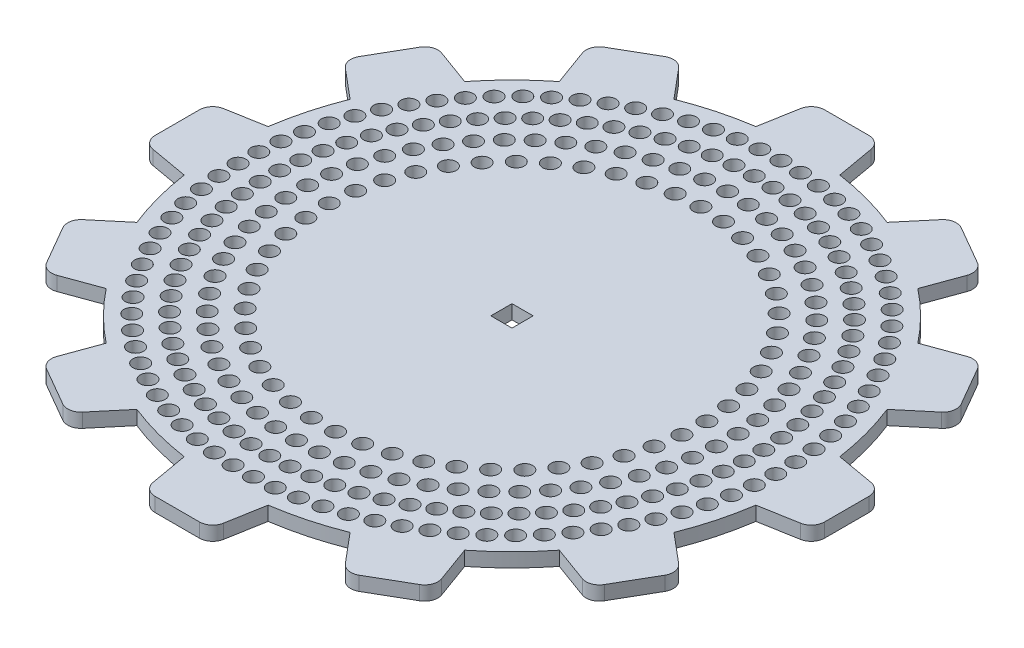
from build123d import *

# Parameters (mm, degrees)
SKETCH1_R           = 130
SKETCH1_R_2         = 3.5
SKETCH1_W           = 9.525
SKETCH1_H           = 9.525
BOSS_EXTRUDE1_DEPTH = 6.35
BOSS_EXTRUDE2_START = -6.35
BOSS_EXTRUDE2_DEPTH = 6.35
FILLET3_R           = 6
FILLET4_R           = 6


with BuildPart() as part:
    # Sketch1 → Boss-Extrude1 (new body)
    with BuildSketch(Plane(origin=(0, 0, 0), x_dir=(1, 0, 0), z_dir=(0, 1, 0))):
        with Locations(Location((0, 0, 0), (0, 0, 270))):
            Circle(SKETCH1_R)
        with Locations(Location((0, 85, 0), (0, 0, 270))):
            Circle(SKETCH1_R_2, mode=Mode.SUBTRACT)
        with Locations(Location((0, 97, 0), (0, 0, 270))):
            Circle(SKETCH1_R_2, mode=Mode.SUBTRACT)
        with Locations(Location((0, 109, 0), (0, 0, 270))):
            Circle(SKETCH1_R_2, mode=Mode.SUBTRACT)
        with Locations(Location((0, 121, 0), (0, 0, 270))):
            Circle(SKETCH1_R_2, mode=Mode.SUBTRACT)
        with Locations(Location((9.151078252, 120.653461479, 0), (0, 0, 270))):
            Circle(SKETCH1_R_2, mode=Mode.SUBTRACT)
        with Locations(Location((18.249739957, 119.615830857, 0), (0, 0, 270))):
            Circle(SKETCH1_R_2, mode=Mode.SUBTRACT)
        with Locations(Location((27.243868803, 117.893051588, 0), (0, 0, 270))):
            Circle(SKETCH1_R_2, mode=Mode.SUBTRACT)
        with Locations(Location((36.081947237, 115.494991595, 0), (0, 0, 270))):
            Circle(SKETCH1_R_2, mode=Mode.SUBTRACT)
        with Locations(Location((44.713351544, 112.43538675, 0), (0, 0, 270))):
            Circle(SKETCH1_R_2, mode=Mode.SUBTRACT)
        with Locations(Location((53.088641823, 108.731762192, 0), (0, 0, 270))):
            Circle(SKETCH1_R_2, mode=Mode.SUBTRACT)
        with Locations(Location((61.159845169, 104.405331947, 0), (0, 0, 270))):
            Circle(SKETCH1_R_2, mode=Mode.SUBTRACT)
        with Locations(Location((68.88073046, 99.480877415, 0), (0, 0, 270))):
            Circle(SKETCH1_R_2, mode=Mode.SUBTRACT)
        with Locations(Location((76.207073165, 93.986605426, 0), (0, 0, 270))):
            Circle(SKETCH1_R_2, mode=Mode.SUBTRACT)
        with Locations(Location((83.096908657, 87.953986673, 0), (0, 0, 270))):
            Circle(SKETCH1_R_2, mode=Mode.SUBTRACT)
        with Locations(Location((89.510772581, 81.417575449, 0), (0, 0, 270))):
            Circle(SKETCH1_R_2, mode=Mode.SUBTRACT)
        with Locations(Location((95.411926905, 74.414811726, 0), (0, 0, 270))):
            Circle(SKETCH1_R_2, mode=Mode.SUBTRACT)
        with Locations(Location((100.766570353, 66.985806701, 0), (0, 0, 270))):
            Circle(SKETCH1_R_2, mode=Mode.SUBTRACT)
        with Locations(Location((105.544032011, 59.17311304, 0), (0, 0, 270))):
            Circle(SKETCH1_R_2, mode=Mode.SUBTRACT)
        with Locations(Location((109.716947011, 51.021481147, 0), (0, 0, 270))):
            Circle(SKETCH1_R_2, mode=Mode.SUBTRACT)
        with Locations(Location((113.261413276, 42.577602831, 0), (0, 0, 270))):
            Circle(SKETCH1_R_2, mode=Mode.SUBTRACT)
        with Locations(Location((116.157128421, 33.889843861, 0), (0, 0, 270))):
            Circle(SKETCH1_R_2, mode=Mode.SUBTRACT)
        with Locations(Location((118.387506054, 25.007966935, 0), (0, 0, 270))):
            Circle(SKETCH1_R_2, mode=Mode.SUBTRACT)
        with Locations(Location((119.939770774, 15.982846639, 0), (0, 0, 270))):
            Circle(SKETCH1_R_2, mode=Mode.SUBTRACT)
        with Locations(Location((120.805031348, 6.866178044, 0), (0, 0, 270))):
            Circle(SKETCH1_R_2, mode=Mode.SUBTRACT)
        with Locations(Location((120.978331643, -2.289819396, 0), (0, 0, 270))):
            Circle(SKETCH1_R_2, mode=Mode.SUBTRACT)
        with Locations(Location((120.45867901, -11.432700958, 0), (0, 0, 270))):
            Circle(SKETCH1_R_2, mode=Mode.SUBTRACT)
        with Locations(Location((119.249049972, -20.510097045, 0), (0, 0, 270))):
            Circle(SKETCH1_R_2, mode=Mode.SUBTRACT)
        with Locations(Location((117.356373175, -29.470013153, 0), (0, 0, 270))):
            Circle(SKETCH1_R_2, mode=Mode.SUBTRACT)
        with Locations(Location((114.7914897, -38.261127695, 0), (0, 0, 270))):
            Circle(SKETCH1_R_2, mode=Mode.SUBTRACT)
        with Locations(Location((111.569090968, -46.833085961, 0), (0, 0, 270))):
            Circle(SKETCH1_R_2, mode=Mode.SUBTRACT)
        with Locations(Location((107.707634586, -55.136788553, 0), (0, 0, 270))):
            Circle(SKETCH1_R_2, mode=Mode.SUBTRACT)
        with Locations(Location((103.229238627, -63.124672613, 0), (0, 0, 270))):
            Circle(SKETCH1_R_2, mode=Mode.SUBTRACT)
        with Locations(Location((98.159554937, -70.750984265, 0), (0, 0, 270))):
            Circle(SKETCH1_R_2, mode=Mode.SUBTRACT)
        with Locations(Location((92.527622207, -77.972040686, 0), (0, 0, 270))):
            Circle(SKETCH1_R_2, mode=Mode.SUBTRACT)
        with Locations(Location((86.365699635, -84.746480319, 0), (0, 0, 270))):
            Circle(SKETCH1_R_2, mode=Mode.SUBTRACT)
        with Locations(Location((79.709082157, -91.035499788, 0), (0, 0, 270))):
            Circle(SKETCH1_R_2, mode=Mode.SUBTRACT)
        with Locations(Location((72.595898275, -96.803076158, 0), (0, 0, 270))):
            Circle(SKETCH1_R_2, mode=Mode.SUBTRACT)
        with Locations(Location((65.066891662, -102.016173274, 0), (0, 0, 270))):
            Circle(SKETCH1_R_2, mode=Mode.SUBTRACT)
        with Locations(Location((57.165187786, -106.644930988, 0), (0, 0, 270))):
            Circle(SKETCH1_R_2, mode=Mode.SUBTRACT)
        with Locations(Location((48.936046891, -110.662836195, 0), (0, 0, 270))):
            Circle(SKETCH1_R_2, mode=Mode.SUBTRACT)
        with Locations(Location((40.426604751, -114.046874698, 0), (0, 0, 270))):
            Circle(SKETCH1_R_2, mode=Mode.SUBTRACT)
        with Locations(Location((31.68560268, -116.77766303, 0), (0, 0, 270))):
            Circle(SKETCH1_R_2, mode=Mode.SUBTRACT)
        with Locations(Location((22.763108347, -118.839559484, 0), (0, 0, 270))):
            Circle(SKETCH1_R_2, mode=Mode.SUBTRACT)
        with Locations(Location((13.71022899, -120.220753704, 0), (0, 0, 270))):
            Circle(SKETCH1_R_2, mode=Mode.SUBTRACT)
        with Locations(Location((4.578818683, -120.913334333, 0), (0, 0, 270))):
            Circle(SKETCH1_R_2, mode=Mode.SUBTRACT)
        with Locations(Location((-4.578818683, -120.913334333, 0), (0, 0, 270))):
            Circle(SKETCH1_R_2, mode=Mode.SUBTRACT)
        with Locations(Location((-13.71022899, -120.220753704, 0), (0, 0, 270))):
            Circle(SKETCH1_R_2, mode=Mode.SUBTRACT)
        with Locations(Location((-22.763108347, -118.839559484, 0), (0, 0, 270))):
            Circle(SKETCH1_R_2, mode=Mode.SUBTRACT)
        with Locations(Location((-31.68560268, -116.77766303, 0), (0, 0, 270))):
            Circle(SKETCH1_R_2, mode=Mode.SUBTRACT)
        with Locations(Location((-40.426604751, -114.046874698, 0), (0, 0, 270))):
            Circle(SKETCH1_R_2, mode=Mode.SUBTRACT)
        with Locations(Location((-48.936046891, -110.662836195, 0), (0, 0, 270))):
            Circle(SKETCH1_R_2, mode=Mode.SUBTRACT)
        with Locations(Location((-57.165187786, -106.644930988, 0), (0, 0, 270))):
            Circle(SKETCH1_R_2, mode=Mode.SUBTRACT)
        with Locations(Location((-65.066891662, -102.016173274, 0), (0, 0, 270))):
            Circle(SKETCH1_R_2, mode=Mode.SUBTRACT)
        with Locations(Location((-72.595898275, -96.803076158, 0), (0, 0, 270))):
            Circle(SKETCH1_R_2, mode=Mode.SUBTRACT)
        with Locations(Location((-79.709082157, -91.035499788, 0), (0, 0, 270))):
            Circle(SKETCH1_R_2, mode=Mode.SUBTRACT)
        with Locations(Location((-86.365699635, -84.746480319, 0), (0, 0, 270))):
            Circle(SKETCH1_R_2, mode=Mode.SUBTRACT)
        with Locations(Location((-92.527622207, -77.972040686, 0), (0, 0, 270))):
            Circle(SKETCH1_R_2, mode=Mode.SUBTRACT)
        with Locations(Location((-98.159554937, -70.750984265, 0), (0, 0, 270))):
            Circle(SKETCH1_R_2, mode=Mode.SUBTRACT)
        with Locations(Location((-103.229238627, -63.124672613, 0), (0, 0, 270))):
            Circle(SKETCH1_R_2, mode=Mode.SUBTRACT)
        with Locations(Location((-107.707634586, -55.136788553, 0), (0, 0, 270))):
            Circle(SKETCH1_R_2, mode=Mode.SUBTRACT)
        with Locations(Location((-111.569090968, -46.833085961, 0), (0, 0, 270))):
            Circle(SKETCH1_R_2, mode=Mode.SUBTRACT)
        with Locations(Location((-114.7914897, -38.261127695, 0), (0, 0, 270))):
            Circle(SKETCH1_R_2, mode=Mode.SUBTRACT)
        with Locations(Location((-117.356373175, -29.470013153, 0), (0, 0, 270))):
            Circle(SKETCH1_R_2, mode=Mode.SUBTRACT)
        with Locations(Location((-119.249049972, -20.510097045, 0), (0, 0, 270))):
            Circle(SKETCH1_R_2, mode=Mode.SUBTRACT)
        with Locations(Location((-120.45867901, -11.432700958, 0), (0, 0, 270))):
            Circle(SKETCH1_R_2, mode=Mode.SUBTRACT)
        with Locations(Location((-120.978331643, -2.289819396, 0), (0, 0, 270))):
            Circle(SKETCH1_R_2, mode=Mode.SUBTRACT)
        with Locations(Location((-120.805031348, 6.866178044, 0), (0, 0, 270))):
            Circle(SKETCH1_R_2, mode=Mode.SUBTRACT)
        with Locations(Location((-119.939770774, 15.982846639, 0), (0, 0, 270))):
            Circle(SKETCH1_R_2, mode=Mode.SUBTRACT)
        with Locations(Location((-118.387506054, 25.007966935, 0), (0, 0, 270))):
            Circle(SKETCH1_R_2, mode=Mode.SUBTRACT)
        with Locations(Location((8.77085599, 108.646546587, 0), (0, 0, 270))):
            Circle(SKETCH1_R_2, mode=Mode.SUBTRACT)
        with Locations(Location((17.484829613, 107.588478628, 0), (0, 0, 270))):
            Circle(SKETCH1_R_2, mode=Mode.SUBTRACT)
        with Locations(Location((26.085407407, 105.832658099, 0), (0, 0, 270))):
            Circle(SKETCH1_R_2, mode=Mode.SUBTRACT)
        with Locations(Location((34.516811324, 103.390472172, 0), (0, 0, 270))):
            Circle(SKETCH1_R_2, mode=Mode.SUBTRACT)
        with Locations(Location((42.724360475, 100.277759359, 0), (0, 0, 270))):
            Circle(SKETCH1_R_2, mode=Mode.SUBTRACT)
        with Locations(Location((50.654825753, 96.514706796, 0), (0, 0, 270))):
            Circle(SKETCH1_R_2, mode=Mode.SUBTRACT)
        with Locations(Location((58.256775048, 92.125719324, 0), (0, 0, 270))):
            Circle(SKETCH1_R_2, mode=Mode.SUBTRACT)
        with Locations(Location((65.480906802, 87.139261211, 0), (0, 0, 270))):
            Circle(SKETCH1_R_2, mode=Mode.SUBTRACT)
        with Locations(Location((72.280369748, 81.587671551, 0), (0, 0, 270))):
            Circle(SKETCH1_R_2, mode=Mode.SUBTRACT)
        with Locations(Location((78.61106676, 75.506954533, 0), (0, 0, 270))):
            Circle(SKETCH1_R_2, mode=Mode.SUBTRACT)
        with Locations(Location((84.431940839, 68.93654594, 0), (0, 0, 270))):
            Circle(SKETCH1_R_2, mode=Mode.SUBTRACT)
        with Locations(Location((89.705241382, 61.919057394, 0), (0, 0, 270))):
            Circle(SKETCH1_R_2, mode=Mode.SUBTRACT)
        with Locations(Location((94.396769013, 54.5, 0), (0, 0, 270))):
            Circle(SKETCH1_R_2, mode=Mode.SUBTRACT)
        with Locations(Location((98.476097373, 46.727489193, 0), (0, 0, 270))):
            Circle(SKETCH1_R_2, mode=Mode.SUBTRACT)
        with Locations(Location((101.916770453, 38.651932688, 0), (0, 0, 270))):
            Circle(SKETCH1_R_2, mode=Mode.SUBTRACT)
        with Locations(Location((104.696474168, 30.325703567, 0), (0, 0, 270))):
            Circle(SKETCH1_R_2, mode=Mode.SUBTRACT)
        with Locations(Location((106.797181073, 21.802800622, 0), (0, 0, 270))):
            Circle(SKETCH1_R_2, mode=Mode.SUBTRACT)
        with Locations(Location((108.205267277, 13.138498148, 0), (0, 0, 270))):
            Circle(SKETCH1_R_2, mode=Mode.SUBTRACT)
        with Locations(Location((108.911600801, 4.388987472, 0), (0, 0, 270))):
            Circle(SKETCH1_R_2, mode=Mode.SUBTRACT)
        with Locations(Location((108.911600801, -4.388987472, 0), (0, 0, 270))):
            Circle(SKETCH1_R_2, mode=Mode.SUBTRACT)
        with Locations(Location((108.205267277, -13.138498148, 0), (0, 0, 270))):
            Circle(SKETCH1_R_2, mode=Mode.SUBTRACT)
        with Locations(Location((106.797181073, -21.802800622, 0), (0, 0, 270))):
            Circle(SKETCH1_R_2, mode=Mode.SUBTRACT)
        with Locations(Location((104.696474168, -30.325703567, 0), (0, 0, 270))):
            Circle(SKETCH1_R_2, mode=Mode.SUBTRACT)
        with Locations(Location((101.916770453, -38.651932688, 0), (0, 0, 270))):
            Circle(SKETCH1_R_2, mode=Mode.SUBTRACT)
        with Locations(Location((98.476097373, -46.727489193, 0), (0, 0, 270))):
            Circle(SKETCH1_R_2, mode=Mode.SUBTRACT)
        with Locations(Location((94.396769013, -54.5, 0), (0, 0, 270))):
            Circle(SKETCH1_R_2, mode=Mode.SUBTRACT)
        with Locations(Location((89.705241382, -61.919057394, 0), (0, 0, 270))):
            Circle(SKETCH1_R_2, mode=Mode.SUBTRACT)
        with Locations(Location((84.431940839, -68.93654594, 0), (0, 0, 270))):
            Circle(SKETCH1_R_2, mode=Mode.SUBTRACT)
        with Locations(Location((78.61106676, -75.506954533, 0), (0, 0, 270))):
            Circle(SKETCH1_R_2, mode=Mode.SUBTRACT)
        with Locations(Location((72.280369748, -81.587671551, 0), (0, 0, 270))):
            Circle(SKETCH1_R_2, mode=Mode.SUBTRACT)
        with Locations(Location((65.480906802, -87.139261211, 0), (0, 0, 270))):
            Circle(SKETCH1_R_2, mode=Mode.SUBTRACT)
        with Locations(Location((58.256775048, -92.125719324, 0), (0, 0, 270))):
            Circle(SKETCH1_R_2, mode=Mode.SUBTRACT)
        with Locations(Location((50.654825753, -96.514706796, 0), (0, 0, 270))):
            Circle(SKETCH1_R_2, mode=Mode.SUBTRACT)
        with Locations(Location((42.724360475, -100.277759359, 0), (0, 0, 270))):
            Circle(SKETCH1_R_2, mode=Mode.SUBTRACT)
        with Locations(Location((34.516811324, -103.390472172, 0), (0, 0, 270))):
            Circle(SKETCH1_R_2, mode=Mode.SUBTRACT)
        with Locations(Location((26.085407407, -105.832658099, 0), (0, 0, 270))):
            Circle(SKETCH1_R_2, mode=Mode.SUBTRACT)
        with Locations(Location((17.484829614, -107.588478628, 0), (0, 0, 270))):
            Circle(SKETCH1_R_2, mode=Mode.SUBTRACT)
        with Locations(Location((8.77085599, -108.646546587, 0), (0, 0, 270))):
            Circle(SKETCH1_R_2, mode=Mode.SUBTRACT)
        with Locations(Location((0, -109, 0), (0, 0, 270))):
            Circle(SKETCH1_R_2, mode=Mode.SUBTRACT)
        with Locations(Location((-8.77085599, -108.646546587, 0), (0, 0, 270))):
            Circle(SKETCH1_R_2, mode=Mode.SUBTRACT)
        with Locations(Location((-17.484829613, -107.588478628, 0), (0, 0, 270))):
            Circle(SKETCH1_R_2, mode=Mode.SUBTRACT)
        with Locations(Location((-26.085407407, -105.832658099, 0), (0, 0, 270))):
            Circle(SKETCH1_R_2, mode=Mode.SUBTRACT)
        with Locations(Location((-34.516811324, -103.390472172, 0), (0, 0, 270))):
            Circle(SKETCH1_R_2, mode=Mode.SUBTRACT)
        with Locations(Location((-42.724360475, -100.277759359, 0), (0, 0, 270))):
            Circle(SKETCH1_R_2, mode=Mode.SUBTRACT)
        with Locations(Location((-50.654825753, -96.514706796, 0), (0, 0, 270))):
            Circle(SKETCH1_R_2, mode=Mode.SUBTRACT)
        with Locations(Location((-58.256775048, -92.125719324, 0), (0, 0, 270))):
            Circle(SKETCH1_R_2, mode=Mode.SUBTRACT)
        with Locations(Location((-65.480906802, -87.139261211, 0), (0, 0, 270))):
            Circle(SKETCH1_R_2, mode=Mode.SUBTRACT)
        with Locations(Location((-72.280369748, -81.587671551, 0), (0, 0, 270))):
            Circle(SKETCH1_R_2, mode=Mode.SUBTRACT)
        with Locations(Location((-78.61106676, -75.506954533, 0), (0, 0, 270))):
            Circle(SKETCH1_R_2, mode=Mode.SUBTRACT)
        with Locations(Location((-84.431940839, -68.93654594, 0), (0, 0, 270))):
            Circle(SKETCH1_R_2, mode=Mode.SUBTRACT)
        with Locations(Location((-89.705241382, -61.919057394, 0), (0, 0, 270))):
            Circle(SKETCH1_R_2, mode=Mode.SUBTRACT)
        with Locations(Location((-94.396769012, -54.5, 0), (0, 0, 270))):
            Circle(SKETCH1_R_2, mode=Mode.SUBTRACT)
        with Locations(Location((-98.476097373, -46.727489193, 0), (0, 0, 270))):
            Circle(SKETCH1_R_2, mode=Mode.SUBTRACT)
        with Locations(Location((-101.916770453, -38.651932688, 0), (0, 0, 270))):
            Circle(SKETCH1_R_2, mode=Mode.SUBTRACT)
        with Locations(Location((9.813327233, 96.502324369, 0), (0, 0, 270))):
            Circle(SKETCH1_R_2, mode=Mode.SUBTRACT)
        with Locations(Location((19.525956449, 95.014404301, 0), (0, 0, 270))):
            Circle(SKETCH1_R_2, mode=Mode.SUBTRACT)
        with Locations(Location((29.038222928, 92.551507871, 0), (0, 0, 270))):
            Circle(SKETCH1_R_2, mode=Mode.SUBTRACT)
        with Locations(Location((38.252517946, 89.138907727, 0), (0, 0, 270))):
            Circle(SKETCH1_R_2, mode=Mode.SUBTRACT)
        with Locations(Location((47.074290366, 84.811621766, 0), (0, 0, 270))):
            Circle(SKETCH1_R_2, mode=Mode.SUBTRACT)
        with Locations(Location((55.413016864, 79.614053797, 0), (0, 0, 270))):
            Circle(SKETCH1_R_2, mode=Mode.SUBTRACT)
        with Locations(Location((63.183130824, 73.599537901, 0), (0, 0, 270))):
            Circle(SKETCH1_R_2, mode=Mode.SUBTRACT)
        with Locations(Location((70.304900361, 66.82979115, 0), (0, 0, 270))):
            Circle(SKETCH1_R_2, mode=Mode.SUBTRACT)
        with Locations(Location((76.705246483, 59.374280307, 0), (0, 0, 270))):
            Circle(SKETCH1_R_2, mode=Mode.SUBTRACT)
        with Locations(Location((82.318492977, 51.309509002, 0), (0, 0, 270))):
            Circle(SKETCH1_R_2, mode=Mode.SUBTRACT)
        with Locations(Location((87.087040338, 42.718232701, 0), (0, 0, 270))):
            Circle(SKETCH1_R_2, mode=Mode.SUBTRACT)
        with Locations(Location((90.961956818, 33.688609526, 0), (0, 0, 270))):
            Circle(SKETCH1_R_2, mode=Mode.SUBTRACT)
        with Locations(Location((93.90348053, 24.313295629, 0), (0, 0, 270))):
            Circle(SKETCH1_R_2, mode=Mode.SUBTRACT)
        with Locations(Location((95.88142746, 14.688494418, 0), (0, 0, 270))):
            Circle(SKETCH1_R_2, mode=Mode.SUBTRACT)
        with Locations(Location((96.875501196, 4.912969377, 0), (0, 0, 270))):
            Circle(SKETCH1_R_2, mode=Mode.SUBTRACT)
        with Locations(Location((96.875501196, -4.912969377, 0), (0, 0, 270))):
            Circle(SKETCH1_R_2, mode=Mode.SUBTRACT)
        with Locations(Location((95.88142746, -14.688494418, 0), (0, 0, 270))):
            Circle(SKETCH1_R_2, mode=Mode.SUBTRACT)
        with Locations(Location((93.90348053, -24.313295629, 0), (0, 0, 270))):
            Circle(SKETCH1_R_2, mode=Mode.SUBTRACT)
        with Locations(Location((90.961956818, -33.688609526, 0), (0, 0, 270))):
            Circle(SKETCH1_R_2, mode=Mode.SUBTRACT)
        with Locations(Location((87.087040338, -42.718232701, 0), (0, 0, 270))):
            Circle(SKETCH1_R_2, mode=Mode.SUBTRACT)
        with Locations(Location((82.318492977, -51.309509002, 0), (0, 0, 270))):
            Circle(SKETCH1_R_2, mode=Mode.SUBTRACT)
        with Locations(Location((76.705246483, -59.374280307, 0), (0, 0, 270))):
            Circle(SKETCH1_R_2, mode=Mode.SUBTRACT)
        with Locations(Location((70.304900361, -66.82979115, 0), (0, 0, 270))):
            Circle(SKETCH1_R_2, mode=Mode.SUBTRACT)
        with Locations(Location((63.183130824, -73.599537901, 0), (0, 0, 270))):
            Circle(SKETCH1_R_2, mode=Mode.SUBTRACT)
        with Locations(Location((55.413016864, -79.614053797, 0), (0, 0, 270))):
            Circle(SKETCH1_R_2, mode=Mode.SUBTRACT)
        with Locations(Location((47.074290366, -84.811621766, 0), (0, 0, 270))):
            Circle(SKETCH1_R_2, mode=Mode.SUBTRACT)
        with Locations(Location((38.252517946, -89.138907727, 0), (0, 0, 270))):
            Circle(SKETCH1_R_2, mode=Mode.SUBTRACT)
        with Locations(Location((29.038222928, -92.551507871, 0), (0, 0, 270))):
            Circle(SKETCH1_R_2, mode=Mode.SUBTRACT)
        with Locations(Location((19.525956449, -95.014404301, 0), (0, 0, 270))):
            Circle(SKETCH1_R_2, mode=Mode.SUBTRACT)
        with Locations(Location((9.813327233, -96.502324369, 0), (0, 0, 270))):
            Circle(SKETCH1_R_2, mode=Mode.SUBTRACT)
        with Locations(Location((0, -97, 0), (0, 0, 270))):
            Circle(SKETCH1_R_2, mode=Mode.SUBTRACT)
        with Locations(Location((-9.813327233, -96.502324369, 0), (0, 0, 270))):
            Circle(SKETCH1_R_2, mode=Mode.SUBTRACT)
        with Locations(Location((-19.525956449, -95.014404301, 0), (0, 0, 270))):
            Circle(SKETCH1_R_2, mode=Mode.SUBTRACT)
        with Locations(Location((-29.038222928, -92.551507871, 0), (0, 0, 270))):
            Circle(SKETCH1_R_2, mode=Mode.SUBTRACT)
        with Locations(Location((-38.252517946, -89.138907727, 0), (0, 0, 270))):
            Circle(SKETCH1_R_2, mode=Mode.SUBTRACT)
        with Locations(Location((-47.074290366, -84.811621766, 0), (0, 0, 270))):
            Circle(SKETCH1_R_2, mode=Mode.SUBTRACT)
        with Locations(Location((-55.413016864, -79.614053797, 0), (0, 0, 270))):
            Circle(SKETCH1_R_2, mode=Mode.SUBTRACT)
        with Locations(Location((-63.183130824, -73.599537901, 0), (0, 0, 270))):
            Circle(SKETCH1_R_2, mode=Mode.SUBTRACT)
        with Locations(Location((-70.304900361, -66.82979115, 0), (0, 0, 270))):
            Circle(SKETCH1_R_2, mode=Mode.SUBTRACT)
        with Locations(Location((-76.705246483, -59.374280307, 0), (0, 0, 270))):
            Circle(SKETCH1_R_2, mode=Mode.SUBTRACT)
        with Locations(Location((-82.318492977, -51.309509002, 0), (0, 0, 270))):
            Circle(SKETCH1_R_2, mode=Mode.SUBTRACT)
        with Locations(Location((-87.087040338, -42.718232701, 0), (0, 0, 270))):
            Circle(SKETCH1_R_2, mode=Mode.SUBTRACT)
        with Locations(Location((-90.961956818, -33.688609526, 0), (0, 0, 270))):
            Circle(SKETCH1_R_2, mode=Mode.SUBTRACT)
        with Locations(Location((-93.90348053, -24.313295629, 0), (0, 0, 270))):
            Circle(SKETCH1_R_2, mode=Mode.SUBTRACT)
        with Locations(Location((-95.88142746, -14.688494418, 0), (0, 0, 270))):
            Circle(SKETCH1_R_2, mode=Mode.SUBTRACT)
        with Locations(Location((-96.875501196, -4.912969377, 0), (0, 0, 270))):
            Circle(SKETCH1_R_2, mode=Mode.SUBTRACT)
        with Locations(Location((-96.875501196, 4.912969377, 0), (0, 0, 270))):
            Circle(SKETCH1_R_2, mode=Mode.SUBTRACT)
        with Locations(Location((-95.88142746, 14.688494418, 0), (0, 0, 270))):
            Circle(SKETCH1_R_2, mode=Mode.SUBTRACT)
        with Locations(Location((-93.90348053, 24.313295629, 0), (0, 0, 270))):
            Circle(SKETCH1_R_2, mode=Mode.SUBTRACT)
        with Locations(Location((-90.961956818, 33.688609526, 0), (0, 0, 270))):
            Circle(SKETCH1_R_2, mode=Mode.SUBTRACT)
        with Locations(Location((-87.087040338, 42.718232701, 0), (0, 0, 270))):
            Circle(SKETCH1_R_2, mode=Mode.SUBTRACT)
        with Locations(Location((10.869558743, 84.302151175, 0), (0, 0, 270))):
            Circle(SKETCH1_R_2, mode=Mode.SUBTRACT)
        with Locations(Location((21.560639632, 82.220063358, 0), (0, 0, 270))):
            Circle(SKETCH1_R_2, mode=Mode.SUBTRACT)
        with Locations(Location((31.897695415, 78.787924374, 0), (0, 0, 270))):
            Circle(SKETCH1_R_2, mode=Mode.SUBTRACT)
        with Locations(Location((41.71099192, 74.06208985, 0), (0, 0, 270))):
            Circle(SKETCH1_R_2, mode=Mode.SUBTRACT)
        with Locations(Location((50.839395092, 68.120157859, 0), (0, 0, 270))):
            Circle(SKETCH1_R_2, mode=Mode.SUBTRACT)
        with Locations(Location((59.133016801, 61.059694758, 0), (0, 0, 270))):
            Circle(SKETCH1_R_2, mode=Mode.SUBTRACT)
        with Locations(Location((66.45567601, 52.996633158, 0), (0, 0, 270))):
            Circle(SKETCH1_R_2, mode=Mode.SUBTRACT)
        with Locations(Location((72.687134855, 44.063368306, 0), (0, 0, 270))):
            Circle(SKETCH1_R_2, mode=Mode.SUBTRACT)
        with Locations(Location((77.725072956, 34.406584165, 0), (0, 0, 270))):
            Circle(SKETCH1_R_2, mode=Mode.SUBTRACT)
        with Locations(Location((81.486767508, 24.184844864, 0), (0, 0, 270))):
            Circle(SKETCH1_R_2, mode=Mode.SUBTRACT)
        with Locations(Location((83.91045159, 13.565991078, 0), (0, 0, 270))):
            Circle(SKETCH1_R_2, mode=Mode.SUBTRACT)
        with Locations(Location((84.956328377, 2.724384094, 0), (0, 0, 270))):
            Circle(SKETCH1_R_2, mode=Mode.SUBTRACT)
        with Locations(Location((84.607224601, -8.161957202, 0), (0, 0, 270))):
            Circle(SKETCH1_R_2, mode=Mode.SUBTRACT)
        with Locations(Location((82.868872535, -18.914279386, 0), (0, 0, 270))):
            Circle(SKETCH1_R_2, mode=Mode.SUBTRACT)
        with Locations(Location((79.769815874, -29.356029626, 0), (0, 0, 270))):
            Circle(SKETCH1_R_2, mode=Mode.SUBTRACT)
        with Locations(Location((75.360941042, -39.31575467, 0), (0, 0, 270))):
            Circle(SKETCH1_R_2, mode=Mode.SUBTRACT)
        with Locations(Location((69.714641641, -48.62991611, 0), (0, 0, 270))):
            Circle(SKETCH1_R_2, mode=Mode.SUBTRACT)
        with Locations(Location((62.923629751, -57.145575672, 0), (0, 0, 270))):
            Circle(SKETCH1_R_2, mode=Mode.SUBTRACT)
        with Locations(Location((55.099413601, -64.722906461, 0), (0, 0, 270))):
            Circle(SKETCH1_R_2, mode=Mode.SUBTRACT)
        with Locations(Location((46.370466603, -71.237488916, 0), (0, 0, 270))):
            Circle(SKETCH1_R_2, mode=Mode.SUBTRACT)
        with Locations(Location((36.880117825, -76.582353772, 0), (0, 0, 270))):
            Circle(SKETCH1_R_2, mode=Mode.SUBTRACT)
        with Locations(Location((26.784198532, -80.669738496, 0), (0, 0, 270))):
            Circle(SKETCH1_R_2, mode=Mode.SUBTRACT)
        with Locations(Location((16.24848344, -83.432528344, 0), (0, 0, 270))):
            Circle(SKETCH1_R_2, mode=Mode.SUBTRACT)
        with Locations(Location((5.445968698, -84.825358384, 0), (0, 0, 270))):
            Circle(SKETCH1_R_2, mode=Mode.SUBTRACT)
        with Locations(Location((-5.445968698, -84.825358384, 0), (0, 0, 270))):
            Circle(SKETCH1_R_2, mode=Mode.SUBTRACT)
        with Locations(Location((-16.24848344, -83.432528344, 0), (0, 0, 270))):
            Circle(SKETCH1_R_2, mode=Mode.SUBTRACT)
        with Locations(Location((-26.784198532, -80.669738496, 0), (0, 0, 270))):
            Circle(SKETCH1_R_2, mode=Mode.SUBTRACT)
        with Locations(Location((-36.880117825, -76.582353772, 0), (0, 0, 270))):
            Circle(SKETCH1_R_2, mode=Mode.SUBTRACT)
        with Locations(Location((-46.370466603, -71.237488916, 0), (0, 0, 270))):
            Circle(SKETCH1_R_2, mode=Mode.SUBTRACT)
        with Locations(Location((-55.099413601, -64.722906461, 0), (0, 0, 270))):
            Circle(SKETCH1_R_2, mode=Mode.SUBTRACT)
        with Locations(Location((-62.923629751, -57.145575672, 0), (0, 0, 270))):
            Circle(SKETCH1_R_2, mode=Mode.SUBTRACT)
        with Locations(Location((-69.714641641, -48.62991611, 0), (0, 0, 270))):
            Circle(SKETCH1_R_2, mode=Mode.SUBTRACT)
        with Locations(Location((-75.360941042, -39.31575467, 0), (0, 0, 270))):
            Circle(SKETCH1_R_2, mode=Mode.SUBTRACT)
        with Locations(Location((-79.769815874, -29.356029626, 0), (0, 0, 270))):
            Circle(SKETCH1_R_2, mode=Mode.SUBTRACT)
        with Locations(Location((-82.868872535, -18.914279386, 0), (0, 0, 270))):
            Circle(SKETCH1_R_2, mode=Mode.SUBTRACT)
        with Locations(Location((-84.607224601, -8.161957202, 0), (0, 0, 270))):
            Circle(SKETCH1_R_2, mode=Mode.SUBTRACT)
        with Locations(Location((-84.956328377, 2.724384094, 0), (0, 0, 270))):
            Circle(SKETCH1_R_2, mode=Mode.SUBTRACT)
        with Locations(Location((-83.91045159, 13.565991078, 0), (0, 0, 270))):
            Circle(SKETCH1_R_2, mode=Mode.SUBTRACT)
        with Locations(Location((-81.486767508, 24.184844864, 0), (0, 0, 270))):
            Circle(SKETCH1_R_2, mode=Mode.SUBTRACT)
        with Locations(Location((-77.725072956, 34.406584165, 0), (0, 0, 270))):
            Circle(SKETCH1_R_2, mode=Mode.SUBTRACT)
        with Locations(Location((-72.687134855, 44.063368306, 0), (0, 0, 270))):
            Circle(SKETCH1_R_2, mode=Mode.SUBTRACT)
        with Locations(Location((-66.45567601, 52.996633158, 0), (0, 0, 270))):
            Circle(SKETCH1_R_2, mode=Mode.SUBTRACT)
        with Locations(Location((-59.133016801, 61.059694758, 0), (0, 0, 270))):
            Circle(SKETCH1_R_2, mode=Mode.SUBTRACT)
        with Locations(Location((-50.839395092, 68.120157859, 0), (0, 0, 270))):
            Circle(SKETCH1_R_2, mode=Mode.SUBTRACT)
        with Locations(Location((-41.71099192, 74.06208985, 0), (0, 0, 270))):
            Circle(SKETCH1_R_2, mode=Mode.SUBTRACT)
        with Locations(Location((-31.897695415, 78.787924374, 0), (0, 0, 270))):
            Circle(SKETCH1_R_2, mode=Mode.SUBTRACT)
        with Locations(Location((-21.560639632, 82.220063358, 0), (0, 0, 270))):
            Circle(SKETCH1_R_2, mode=Mode.SUBTRACT)
        with Locations(Location((-10.869558743, 84.302151175, 0), (0, 0, 270))):
            Circle(SKETCH1_R_2, mode=Mode.SUBTRACT)
        with Locations(Location((-82.318492977, 51.309509002, 0), (0, 0, 270))):
            Circle(SKETCH1_R_2, mode=Mode.SUBTRACT)
        with Locations(Location((-76.705246483, 59.374280307, 0), (0, 0, 270))):
            Circle(SKETCH1_R_2, mode=Mode.SUBTRACT)
        with Locations(Location((-70.304900361, 66.82979115, 0), (0, 0, 270))):
            Circle(SKETCH1_R_2, mode=Mode.SUBTRACT)
        with Locations(Location((-63.183130824, 73.599537901, 0), (0, 0, 270))):
            Circle(SKETCH1_R_2, mode=Mode.SUBTRACT)
        with Locations(Location((-55.413016864, 79.614053797, 0), (0, 0, 270))):
            Circle(SKETCH1_R_2, mode=Mode.SUBTRACT)
        with Locations(Location((-47.074290366, 84.811621766, 0), (0, 0, 270))):
            Circle(SKETCH1_R_2, mode=Mode.SUBTRACT)
        with Locations(Location((-38.252517946, 89.138907727, 0), (0, 0, 270))):
            Circle(SKETCH1_R_2, mode=Mode.SUBTRACT)
        with Locations(Location((-29.038222928, 92.551507871, 0), (0, 0, 270))):
            Circle(SKETCH1_R_2, mode=Mode.SUBTRACT)
        with Locations(Location((-19.525956449, 95.014404301, 0), (0, 0, 270))):
            Circle(SKETCH1_R_2, mode=Mode.SUBTRACT)
        with Locations(Location((-9.813327233, 96.502324369, 0), (0, 0, 270))):
            Circle(SKETCH1_R_2, mode=Mode.SUBTRACT)
        with Locations(Location((-104.696474168, -30.325703567, 0), (0, 0, 270))):
            Circle(SKETCH1_R_2, mode=Mode.SUBTRACT)
        with Locations(Location((-106.797181073, -21.802800622, 0), (0, 0, 270))):
            Circle(SKETCH1_R_2, mode=Mode.SUBTRACT)
        with Locations(Location((-108.205267277, -13.138498148, 0), (0, 0, 270))):
            Circle(SKETCH1_R_2, mode=Mode.SUBTRACT)
        with Locations(Location((-108.911600801, -4.388987472, 0), (0, 0, 270))):
            Circle(SKETCH1_R_2, mode=Mode.SUBTRACT)
        with Locations(Location((-108.911600801, 4.388987472, 0), (0, 0, 270))):
            Circle(SKETCH1_R_2, mode=Mode.SUBTRACT)
        with Locations(Location((-108.205267277, 13.138498148, 0), (0, 0, 270))):
            Circle(SKETCH1_R_2, mode=Mode.SUBTRACT)
        with Locations(Location((-106.797181073, 21.802800622, 0), (0, 0, 270))):
            Circle(SKETCH1_R_2, mode=Mode.SUBTRACT)
        with Locations(Location((-104.696474168, 30.325703567, 0), (0, 0, 270))):
            Circle(SKETCH1_R_2, mode=Mode.SUBTRACT)
        with Locations(Location((-101.916770453, 38.651932688, 0), (0, 0, 270))):
            Circle(SKETCH1_R_2, mode=Mode.SUBTRACT)
        with Locations(Location((-98.476097373, 46.727489193, 0), (0, 0, 270))):
            Circle(SKETCH1_R_2, mode=Mode.SUBTRACT)
        with Locations(Location((-94.396769012, 54.5, 0), (0, 0, 270))):
            Circle(SKETCH1_R_2, mode=Mode.SUBTRACT)
        with Locations(Location((-89.705241382, 61.919057394, 0), (0, 0, 270))):
            Circle(SKETCH1_R_2, mode=Mode.SUBTRACT)
        with Locations(Location((-84.431940839, 68.93654594, 0), (0, 0, 270))):
            Circle(SKETCH1_R_2, mode=Mode.SUBTRACT)
        with Locations(Location((-78.61106676, 75.506954533, 0), (0, 0, 270))):
            Circle(SKETCH1_R_2, mode=Mode.SUBTRACT)
        with Locations(Location((-72.280369748, 81.587671551, 0), (0, 0, 270))):
            Circle(SKETCH1_R_2, mode=Mode.SUBTRACT)
        with Locations(Location((-65.480906802, 87.139261211, 0), (0, 0, 270))):
            Circle(SKETCH1_R_2, mode=Mode.SUBTRACT)
        with Locations(Location((-58.256775048, 92.125719324, 0), (0, 0, 270))):
            Circle(SKETCH1_R_2, mode=Mode.SUBTRACT)
        with Locations(Location((-50.654825753, 96.514706796, 0), (0, 0, 270))):
            Circle(SKETCH1_R_2, mode=Mode.SUBTRACT)
        with Locations(Location((-42.724360475, 100.277759359, 0), (0, 0, 270))):
            Circle(SKETCH1_R_2, mode=Mode.SUBTRACT)
        with Locations(Location((-34.516811324, 103.390472172, 0), (0, 0, 270))):
            Circle(SKETCH1_R_2, mode=Mode.SUBTRACT)
        with Locations(Location((-26.085407407, 105.832658099, 0), (0, 0, 270))):
            Circle(SKETCH1_R_2, mode=Mode.SUBTRACT)
        with Locations(Location((-17.484829613, 107.588478628, 0), (0, 0, 270))):
            Circle(SKETCH1_R_2, mode=Mode.SUBTRACT)
        with Locations(Location((-8.77085599, 108.646546587, 0), (0, 0, 270))):
            Circle(SKETCH1_R_2, mode=Mode.SUBTRACT)
        with Locations(Location((-116.157128421, 33.889843861, 0), (0, 0, 270))):
            Circle(SKETCH1_R_2, mode=Mode.SUBTRACT)
        with Locations(Location((-113.261413276, 42.577602831, 0), (0, 0, 270))):
            Circle(SKETCH1_R_2, mode=Mode.SUBTRACT)
        with Locations(Location((-109.716947011, 51.021481147, 0), (0, 0, 270))):
            Circle(SKETCH1_R_2, mode=Mode.SUBTRACT)
        with Locations(Location((-105.544032011, 59.17311304, 0), (0, 0, 270))):
            Circle(SKETCH1_R_2, mode=Mode.SUBTRACT)
        with Locations(Location((-100.766570353, 66.985806701, 0), (0, 0, 270))):
            Circle(SKETCH1_R_2, mode=Mode.SUBTRACT)
        with Locations(Location((-95.411926905, 74.414811726, 0), (0, 0, 270))):
            Circle(SKETCH1_R_2, mode=Mode.SUBTRACT)
        with Locations(Location((-89.510772581, 81.417575449, 0), (0, 0, 270))):
            Circle(SKETCH1_R_2, mode=Mode.SUBTRACT)
        with Locations(Location((-83.096908657, 87.953986673, 0), (0, 0, 270))):
            Circle(SKETCH1_R_2, mode=Mode.SUBTRACT)
        with Locations(Location((-76.207073165, 93.986605426, 0), (0, 0, 270))):
            Circle(SKETCH1_R_2, mode=Mode.SUBTRACT)
        with Locations(Location((-68.88073046, 99.480877415, 0), (0, 0, 270))):
            Circle(SKETCH1_R_2, mode=Mode.SUBTRACT)
        with Locations(Location((-61.159845169, 104.405331947, 0), (0, 0, 270))):
            Circle(SKETCH1_R_2, mode=Mode.SUBTRACT)
        with Locations(Location((-53.088641823, 108.731762192, 0), (0, 0, 270))):
            Circle(SKETCH1_R_2, mode=Mode.SUBTRACT)
        with Locations(Location((-44.713351544, 112.43538675, 0), (0, 0, 270))):
            Circle(SKETCH1_R_2, mode=Mode.SUBTRACT)
        with Locations(Location((-36.081947237, 115.494991595, 0), (0, 0, 270))):
            Circle(SKETCH1_R_2, mode=Mode.SUBTRACT)
        with Locations(Location((-27.243868803, 117.893051588, 0), (0, 0, 270))):
            Circle(SKETCH1_R_2, mode=Mode.SUBTRACT)
        with Locations(Location((-18.249739957, 119.615830857, 0), (0, 0, 270))):
            Circle(SKETCH1_R_2, mode=Mode.SUBTRACT)
        with Locations(Location((-9.151078252, 120.653461479, 0), (0, 0, 270))):
            Circle(SKETCH1_R_2, mode=Mode.SUBTRACT)
        Rectangle(SKETCH1_W, SKETCH1_H, mode=Mode.SUBTRACT)
    extrude(amount=BOSS_EXTRUDE1_DEPTH)

    # Sketch2 → Boss-Extrude2 (add)
    with BuildSketch(Plane(origin=(0, 6.35, 0), x_dir=(1, 0, 0), z_dir=(0, 1, 0)).offset(BOSS_EXTRUDE2_START)):
        with BuildLine():
            Line((0, 150.621833488), (15, 150.621833488))
            Line((15, 150.621833488), (18.879193576, 128.621833488))
            ThreePointArc((18.879193576, 128.621833488), (0, 130), (-18.879193576, 128.621833488))
            Line((-18.879193576, 128.621833488), (-15, 150.621833488))
            Line((-15, 150.621833488), (0, 150.621833488))
        make_face()
        with BuildLine():
            Line((62.320535687, 137.942334166), (47.961055505, 120.82937207))
            ThreePointArc((47.961055505, 120.82937207), (65, 112.583302492), (80.660777984, 101.950178495))
            Line((80.660777984, 101.950178495), (88.301297801, 122.942334166))
            Line((88.301297801, 122.942334166), (75.310916744, 130.442334166))
            Line((75.310916744, 130.442334166), (62.320535687, 137.942334166))
        make_face()
        with BuildLine():
            Line((122.942334166, 88.301297801), (101.950178495, 80.660777984))
            ThreePointArc((101.950178495, 80.660777984), (112.583302492, 65), (120.82937207, 47.961055505))
            Line((120.82937207, 47.961055505), (137.942334166, 62.320535687))
            Line((137.942334166, 62.320535687), (130.442334166, 75.310916744))
            Line((130.442334166, 75.310916744), (122.942334166, 88.301297801))
        make_face()
        with BuildLine():
            Line((150.621833488, 15), (128.621833488, 18.879193576))
            ThreePointArc((128.621833488, 18.879193576), (130, 0), (128.621833488, -18.879193576))
            Line((128.621833488, -18.879193576), (150.621833488, -15))
            Line((150.621833488, -15), (150.621833488, 0))
            Line((150.621833488, 0), (150.621833488, 15))
        make_face()
        with BuildLine():
            Line((137.942334166, -62.320535687), (120.82937207, -47.961055505))
            ThreePointArc((120.82937207, -47.961055505), (112.583302492, -65), (101.950178495, -80.660777984))
            Line((101.950178495, -80.660777984), (122.942334166, -88.301297801))
            Line((122.942334166, -88.301297801), (130.442334166, -75.310916744))
            Line((130.442334166, -75.310916744), (137.942334166, -62.320535687))
        make_face()
        with BuildLine():
            Line((88.301297801, -122.942334166), (80.660777984, -101.950178495))
            ThreePointArc((80.660777984, -101.950178495), (65, -112.583302492), (47.961055505, -120.82937207))
            Line((47.961055505, -120.82937207), (62.320535687, -137.942334166))
            Line((62.320535687, -137.942334166), (75.310916744, -130.442334166))
            Line((75.310916744, -130.442334166), (88.301297801, -122.942334166))
        make_face()
        with BuildLine():
            Line((15, -150.621833488), (18.879193576, -128.621833488))
            ThreePointArc((18.879193576, -128.621833488), (0, -130), (-18.879193576, -128.621833488))
            Line((-18.879193576, -128.621833488), (-15, -150.621833488))
            Line((-15, -150.621833488), (0, -150.621833488))
            Line((0, -150.621833488), (15, -150.621833488))
        make_face()
        with BuildLine():
            Line((-62.320535687, -137.942334166), (-47.961055505, -120.82937207))
            ThreePointArc((-47.961055505, -120.82937207), (-65, -112.583302492), (-80.660777984, -101.950178495))
            Line((-80.660777984, -101.950178495), (-88.301297801, -122.942334166))
            Line((-88.301297801, -122.942334166), (-75.310916744, -130.442334166))
            Line((-75.310916744, -130.442334166), (-62.320535687, -137.942334166))
        make_face()
        with BuildLine():
            Line((-122.942334166, -88.301297801), (-101.950178495, -80.660777984))
            ThreePointArc((-101.950178495, -80.660777984), (-112.583302492, -65), (-120.82937207, -47.961055505))
            Line((-120.82937207, -47.961055505), (-137.942334166, -62.320535687))
            Line((-137.942334166, -62.320535687), (-130.442334166, -75.310916744))
            Line((-130.442334166, -75.310916744), (-122.942334166, -88.301297801))
        make_face()
        with BuildLine():
            Line((-150.621833488, -15), (-128.621833488, -18.879193576))
            ThreePointArc((-128.621833488, -18.879193576), (-130, 0), (-128.621833488, 18.879193576))
            Line((-128.621833488, 18.879193576), (-150.621833488, 15))
            Line((-150.621833488, 15), (-150.621833488, 0))
            Line((-150.621833488, 0), (-150.621833488, -15))
        make_face()
        with BuildLine():
            Line((-137.942334166, 62.320535687), (-120.82937207, 47.961055505))
            ThreePointArc((-120.82937207, 47.961055505), (-112.583302492, 65), (-101.950178495, 80.660777984))
            Line((-101.950178495, 80.660777984), (-122.942334166, 88.301297801))
            Line((-122.942334166, 88.301297801), (-130.442334166, 75.310916744))
            Line((-130.442334166, 75.310916744), (-137.942334166, 62.320535687))
        make_face()
        with BuildLine():
            Line((-88.301297801, 122.942334166), (-80.660777984, 101.950178495))
            ThreePointArc((-80.660777984, 101.950178495), (-65, 112.583302492), (-47.961055505, 120.82937207))
            Line((-47.961055505, 120.82937207), (-62.320535687, 137.942334166))
            Line((-62.320535687, 137.942334166), (-75.310916744, 130.442334166))
            Line((-75.310916744, 130.442334166), (-88.301297801, 122.942334166))
        make_face()
    extrude(amount=BOSS_EXTRUDE2_DEPTH)

    # Fillet3
    fillet3_edges = [part.edges().sort_by_distance(p)[0] for p in [
        (-15, 3.175, -150.621833488),
        (15, 3.175, -150.621833488),
        (62.320535687, 3.175, -137.942334166),
        (88.301297801, 3.175, -122.942334166),
        (137.942334166, 3.175, -62.320535687),
        (150.621833488, 3.175, -15),
        (150.621833488, 3.175, 15),
        (137.942334166, 3.175, 62.320535687),
        (122.942334166, 3.175, 88.301297801),
        (88.301297801, 3.175, 122.942334166),
        (62.320535687, 3.175, 137.942334166),
        (15, 3.175, 150.621833488),
        (-15, 3.175, 150.621833488),
        (-62.320535687, 3.175, 137.942334166),
        (-88.301297801, 3.175, 122.942334166),
        (-122.942334166, 3.175, 88.301297801),
        (-137.942334166, 3.175, 62.320535687),
        (-150.621833488, 3.175, 15),
        (-150.621833488, 3.175, -15),
        (-137.942334166, 3.175, -62.320535687),
        (-122.942334166, 3.175, -88.301297801),
        (-88.301297801, 3.175, -122.942334166),
        (-62.320535687, 3.175, -137.942334166),
    ]]
    fillet(fillet3_edges, radius=FILLET3_R)

    # Fillet4
    fillet4_edges = [part.edges().sort_by_distance(p)[0] for p in [
        (122.942334166, 3.175, -88.301297801),
    ]]
    fillet(fillet4_edges, radius=FILLET4_R)


solid = part.part
